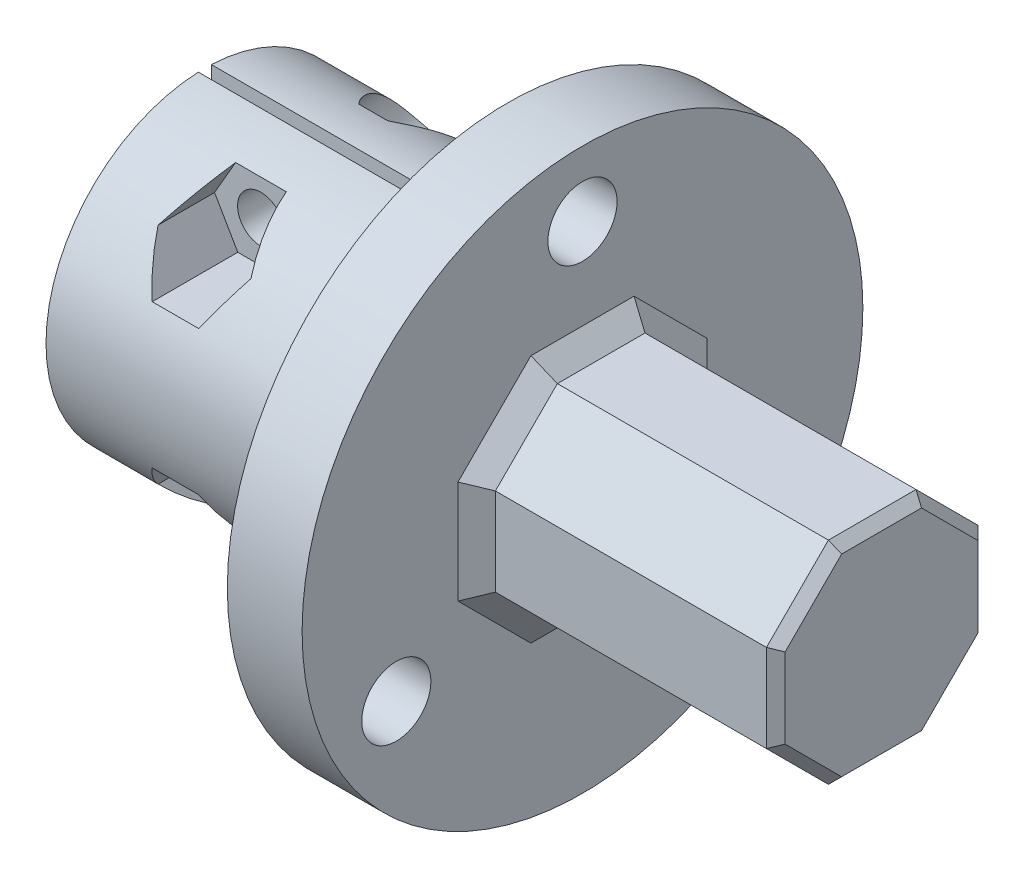
from build123d import *

# Parameters (mm, degrees)
SKETCH1_R               = 8.5
BOSS_EXTRUDE1_DEPTH     = 16.2
SKETCH4_W               = 0.7
SKETCH4_H               = 17
CUT_EXTRUDE2_DEPTH      = 21.172753902
SKETCH5_R               = 15
BOSS_EXTRUDE2_DEPTH     = 4
BOSS_EXTRUDE3_DEPTH     = 16
SKETCH7_R               = 1.85
CUT_EXTRUDE3_DEPTH      = 30.292319813
CHAMFER1_SIZE           = 0.5
CUT_EXTRUDE4_DEPTH      = 42.957597643
CUT_EXTRUDE4_DEPTH_BACK = 42.957597643
SKETCH8_R               = 1.25
CUT_EXTRUDE5_DEPTH      = 44.121224472
SKETCH10_R              = 2.1
CUT_EXTRUDE6_DEPTH      = 44.121224472
FILLET1_R               = 0.5
CHAMFER2_SIZE           = 1


with BuildPart() as part:
    # Sketch1 → Boss-Extrude1 (new body)
    with BuildSketch(Plane(origin=(0, 0, 0), x_dir=(0, 0, -1), z_dir=(1, 0, 0))):
        Circle(SKETCH1_R)
        with BuildLine():
            Line((2.4, 1.882153022), (2.4, -1.882153022))
            ThreePointArc((2.4, -1.882153022), (-3.05, 0), (2.4, 1.882153022))
        make_face(mode=Mode.SUBTRACT)
    extrude(amount=BOSS_EXTRUDE1_DEPTH)

    # Sketch4 → Cut-Extrude2 (cut, through all)
    with BuildSketch(Plane.ZY):
        Rectangle(SKETCH4_W, SKETCH4_H)
    extrude(amount=-CUT_EXTRUDE2_DEPTH, mode=Mode.SUBTRACT)


with BuildPart() as cut_extrude2_piece_1:
    # of the separate pieces the step leaves, piece 1, a body of its own (cut_extrude2_pieces)
    add(part.part.solids().sort_by_distance((0, -8.492791061, -0.35))[0])



with BuildPart() as cut_extrude2_piece_2:
    # of the separate pieces the step leaves, piece 2, a body of its own (cut_extrude2_pieces)
    add(part.part.solids().sort_by_distance((0, 3.029851482, 0.35))[0])


with BuildPart() as cut_extrude2_piece_1_1:
    add(cut_extrude2_piece_1.part)

    add(cut_extrude2_piece_2.part)  # Boss-Extrude2 merges Cut-Extrude2 piece 2
    # Sketch5 → Boss-Extrude2 (add)
    with BuildSketch(Plane(origin=(16.2, 0, 0), x_dir=(0, 0, -1), z_dir=(1, 0, 0))):
        Circle(SKETCH5_R)
    extrude(amount=BOSS_EXTRUDE2_DEPTH)

    # Sketch6 → Boss-Extrude3 (add)
    with BuildSketch(Plane(origin=(20.2, 0, 0), x_dir=(0, 0, -1), z_dir=(1, 0, 0))):
        Polygon((2.343936023, 5.658762137), (-2.343936023, 5.658762137), (-5.658762137, 2.343936023), (-5.658762137, -2.343936023), (-2.343936023, -5.658762137), (2.343936023, -5.658762137), (5.658762137, -2.343936023), (5.658762137, 2.343936023), align=None)
    extrude(amount=BOSS_EXTRUDE3_DEPTH)

    # Sketch7 → Cut-Extrude3 (cut, through all)
    with BuildSketch(Plane(origin=(20.2, 0, 0), x_dir=(0, 0, -1), z_dir=(1, 0, 0))):
        with Locations((0, 11.5)):
            Circle(SKETCH7_R)
        with Locations((-9.959292144, -5.75)):
            Circle(SKETCH7_R)
        with Locations((9.959292144, -5.75)):
            Circle(SKETCH7_R)
    extrude(amount=-CUT_EXTRUDE3_DEPTH, mode=Mode.SUBTRACT)

    # Chamfer1
    chamfer1_edges = [cut_extrude2_piece_1_1.edges().sort_by_distance(p)[0] for p in [
        (36.2, 4.00134908, -4.00134908),
        (36.2, 5.658762137, 0),
        (36.2, 4.00134908, 4.00134908),
        (36.2, 0, 5.658762137),
        (36.2, -4.00134908, 4.00134908),
        (36.2, -5.658762137, 0),
        (36.2, -4.00134908, -4.00134908),
        (36.2, 0, -5.658762137),
    ]]
    chamfer(chamfer1_edges, length=CHAMFER1_SIZE)

    # Sketch8 → Cut-Extrude4 (cut, two sides: drawn at the far end of the back side and taken through both)
    with BuildSketch(Plane.XY.offset(-CUT_EXTRUDE4_DEPTH_BACK)):
        with Locations((6, 6)):
            Circle(SKETCH8_R)
        with Locations((6, -6)):
            Circle(SKETCH8_R)
    extrude(amount=CUT_EXTRUDE4_DEPTH + CUT_EXTRUDE4_DEPTH_BACK, mode=Mode.SUBTRACT)

    # Sketch9 → Cut-Extrude5 (cut, through all)
    with BuildSketch(Plane.XY.offset(3)):
        Polygon((7.241303079, 3.85), (8.482606158, 6), (7.241303079, 8.15), (4.758696921, 8.15), (3.517393842, 6), (4.758696921, 3.85), align=None)
        Polygon((7.241303079, -8.15), (8.482606158, -6), (7.241303079, -3.85), (4.758696921, -3.85), (3.517393842, -6), (4.758696921, -8.15), align=None)
    extrude(amount=CUT_EXTRUDE5_DEPTH, mode=Mode.SUBTRACT)

    # Sketch10 → Cut-Extrude6 (cut, through all)
    with BuildSketch(Plane.XY.offset(-3)):
        with Locations((6, 6)):
            Circle(SKETCH10_R)
        with Locations((6, -6)):
            Circle(SKETCH10_R)
    extrude(amount=-CUT_EXTRUDE6_DEPTH, mode=Mode.SUBTRACT)

    # Fillet1
    fillet1_edges = [cut_extrude2_piece_1_1.edges().sort_by_distance(p)[0] for p in [
        (16.2, 0, 8.5),
        (16.2, 0, -8.5),
    ]]
    fillet(fillet1_edges, radius=FILLET1_R)

    # Chamfer2
    chamfer2_edges = [cut_extrude2_piece_1_1.edges().sort_by_distance(p)[0] for p in [
        (20.2, 4.00134908, -4.00134908),
        (20.2, 5.658762137, 0),
        (20.2, 4.00134908, 4.00134908),
        (20.2, 0, 5.658762137),
        (20.2, -4.00134908, 4.00134908),
        (20.2, -5.658762137, 0),
        (20.2, -4.00134908, -4.00134908),
        (20.2, 0, -5.658762137),
    ]]
    chamfer(chamfer2_edges, length=CHAMFER2_SIZE)


solid = cut_extrude2_piece_1_1.part
